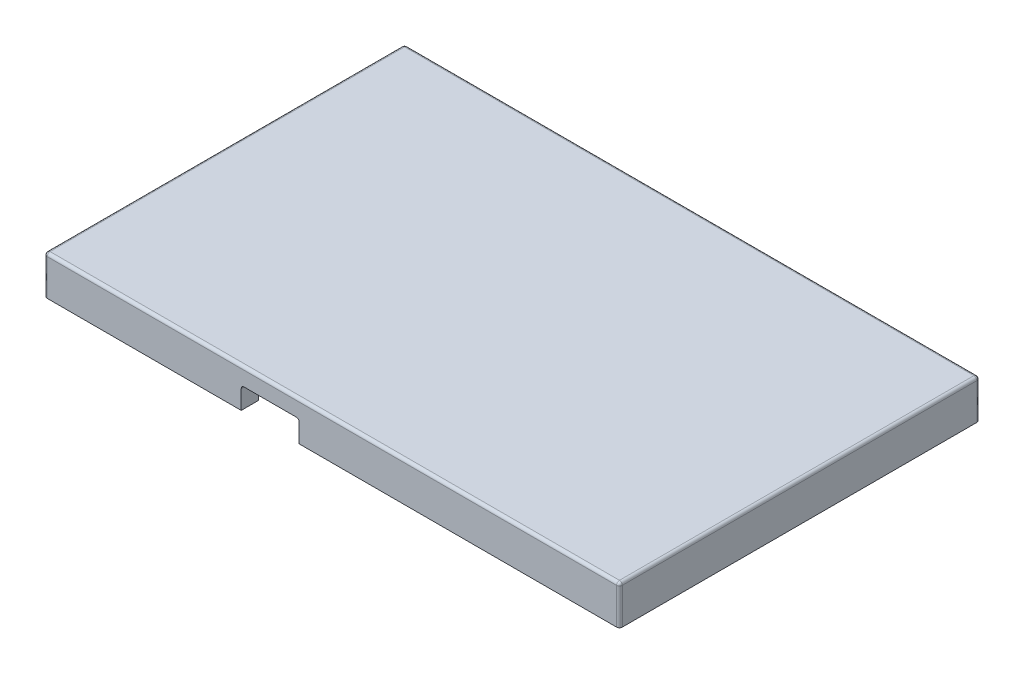
from build123d import *

# Parameters (mm, degrees)
SKETCH1_R           = 1.5
SKETCH1_W           = 14
SKETCH1_H           = 15.525
SKETCH1_W_2         = 46.75
SKETCH1_H_2         = 20.3
BOSS_EXTRUDE1_DEPTH = 3.75
CUT_EXTRUDE1_DEPTH  = 118.232216135
SKETCH3_W           = 99.3
SKETCH3_H           = 62.2
BOSS_EXTRUDE2_DEPTH = 3
SKETCH4_R           = 1.5
CUT_EXTRUDE2_DEPTH  = 4.75
FILLET1_R           = 0.5


with BuildPart() as part:
    # Sketch1 → Boss-Extrude1 (new body)
    with BuildSketch(Plane(origin=(0, 0, 0), x_dir=(1, 0, 0), z_dir=(0, 1, 0))):
        Polygon((0, 62.2), (0, 0), (34, 0), (34, 3), (4.525, 3), (4.525, 18.525), (75.675, 18.525), (75.675, 3), (44, 3), (44, 0), (99.3, 0), (99.3, 62.2), align=None)
        with Locations(Location((10, 25, 0), (0, 0, 270))):
            Circle(SKETCH1_R, mode=Mode.SUBTRACT)
        with Locations(Location((89.25, 10, 0), (0, 0, 270))):
            Circle(SKETCH1_R, mode=Mode.SUBTRACT)
        with Locations((87.725, 29.8125)):
            Rectangle(SKETCH1_W, SKETCH1_H, mode=Mode.SUBTRACT)
        with Locations(Location((25, 47.15, 0), (0, 0, 270))):
            Circle(SKETCH1_R, mode=Mode.SUBTRACT)
        with Locations(Location((74.25, 37.15, 0), (0, 0, 270))):
            Circle(SKETCH1_R, mode=Mode.SUBTRACT)
        with Locations((68.675, 50.3)):
            Rectangle(SKETCH1_W_2, SKETCH1_H_2, mode=Mode.SUBTRACT)
    extrude(amount=BOSS_EXTRUDE1_DEPTH)

    # Sketch2 → Cut-Extrude1 (cut, through all)
    with BuildSketch(Plane.XZ):
        Polygon((19, -18.525), (19, -28), (32, -28), (32, -50), (45.3, -50), (45.3, -40.15), (52, -40.15), (52, -30), (68, -30), (68, -18.525), align=None)
    extrude(amount=-CUT_EXTRUDE1_DEPTH, mode=Mode.SUBTRACT)

    # Sketch3 → Boss-Extrude2 (add)
    with BuildSketch(Plane(origin=(0, 3.75, 0), x_dir=(1, 0, 0), z_dir=(0, 1, 0))):
        with Locations((49.65, 31.1)):
            Rectangle(SKETCH3_W, SKETCH3_H)
    extrude(amount=BOSS_EXTRUDE2_DEPTH)

    # Sketch4 → Cut-Extrude2 (cut)
    with BuildSketch(Plane.XZ):
        with Locations(Location((89.25, -10, 0), (0, 0, 90))):
            Circle(SKETCH4_R)
        with Locations(Location((74.25, -37.15, 0), (0, 0, 90))):
            Circle(SKETCH4_R)
        with Locations(Location((25, -47.15, 0), (0, 0, 90))):
            Circle(SKETCH4_R)
        with Locations(Location((10, -25, 0), (0, 0, 90))):
            Circle(SKETCH4_R)
    extrude(amount=-CUT_EXTRUDE2_DEPTH, mode=Mode.SUBTRACT)

    # Fillet1
    fillet1_edges = [part.edges().sort_by_distance(p)[0] for p in [
        (0, 6.75, -31.1),
        (49.65, 6.75, 0),
        (99.3, 6.75, -31.1),
        (49.65, 6.75, -62.2),
        (0, 3.375, 0),
        (0, 3.375, -62.2),
        (99.3, 3.375, -62.2),
        (99.3, 3.375, 0),
        (34, 3.75, -1.5),
        (44, 3.75, -1.5),
    ]]
    fillet(fillet1_edges, radius=FILLET1_R)


solid = part.part
